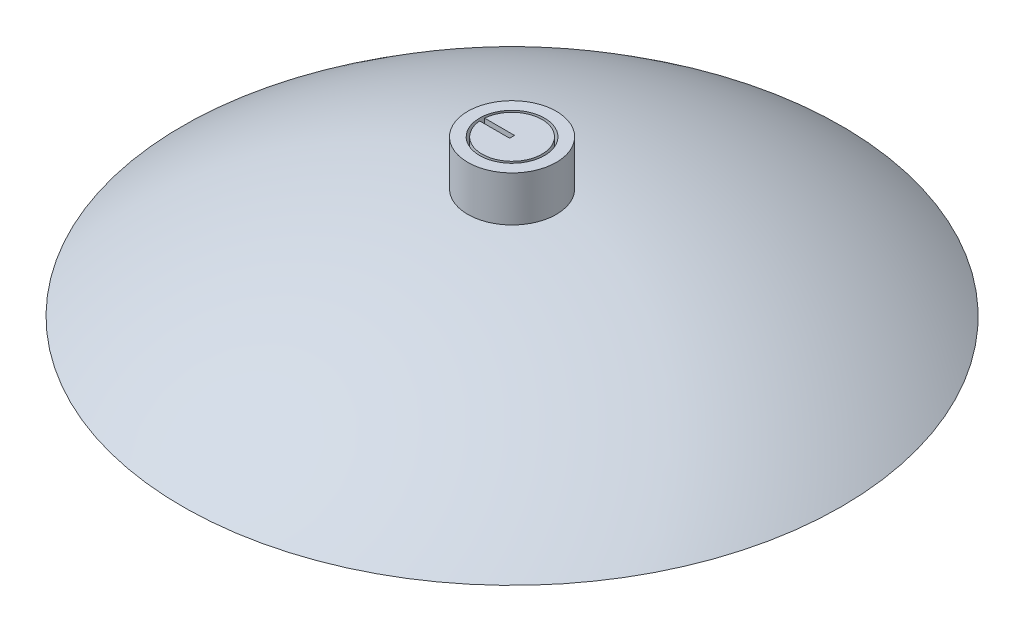
from build123d import *

# Parameters (mm, degrees)
BOSS_EXTRUDE1_REACH      = 319.128
BOSS_EXTRUDE1_END_RADIUS = 348.751469298
SKETCH2_R                = 28.575
CUT_EXTRUDE1_REACH       = 319.128
CUT_EXTRUDE1_END_RADIUS  = 348.751469298
SKETCH3_R                = 20.955
SKETCH3_R_2              = 19.3675
CUT_EXTRUDE2_REACH       = 319.128
CUT_EXTRUDE2_END_RADIUS  = 348.751469298
SKETCH6_R                = 6.985
BOSS_EXTRUDE4_DEPTH      = 19.05
SKETCH7_R                = 5.715
CUT_EXTRUDE3_DEPTH       = 16.51


with BuildPart() as part:
    # Sketch1 → Revolve1 (revolve)
    with BuildSketch(Plane.XY):
        with BuildLine():
            Line((212.725, 0), (191.135, 0))
            ThreePointArc((191.135, 0), (99.243909749, 39.232491681), (0, 50.8))
            Line((0, 50.8), (0, 72.39))
            ThreePointArc((0, 72.39), (112.352389522, 53.796868331), (212.725, 0))
        make_face()
    revolve(axis=Axis((0, 0, 0), (0, -1, 0)))

    # Boss-Extrude1: up to this sphere (the profile starts outside it)
    boss_extrude1_end = Location((0, -276.361469298, 0)) * Sphere(BOSS_EXTRUDE1_END_RADIUS, mode=Mode.PRIVATE)
    # Sketch2 → Boss-Extrude1 (add, up to the surface)
    with BuildSketch(Plane(origin=(0, 100.33, 0), x_dir=(1, 0, 0), z_dir=(0, 1, 0)), mode=Mode.PRIVATE) as boss_extrude1_sk1:
        with Locations(Location((0, 0, 0), (0, 0, 270))):
            Circle(SKETCH2_R)
    boss_extrude1_tool1 = extrude(boss_extrude1_sk1.sketch, amount=-BOSS_EXTRUDE1_REACH, mode=Mode.PRIVATE) - boss_extrude1_end
    add(boss_extrude1_tool1.solids().sort_by_distance((0, 100.33, 0))[0])

    # Cut-Extrude1: up to this sphere (the profile starts outside it)
    cut_extrude1_end = Location((0, -276.361469298, 0)) * Sphere(CUT_EXTRUDE1_END_RADIUS, mode=Mode.PRIVATE)
    # Sketch3 → Cut-Extrude1 (cut, up to the surface)
    with BuildSketch(Plane(origin=(0, 100.33, 0), x_dir=(1, 0, 0), z_dir=(0, 1, 0)), mode=Mode.PRIVATE) as cut_extrude1_sk1:
        with Locations(Location((0, 0, 0), (0, 0, 270))):
            Circle(SKETCH3_R)
        with Locations(Location((0, 0, 0), (0, 0, 270))):
            Circle(SKETCH3_R_2, mode=Mode.SUBTRACT)
    cut_extrude1_tool1 = extrude(cut_extrude1_sk1.sketch, amount=-CUT_EXTRUDE1_REACH, mode=Mode.PRIVATE) - cut_extrude1_end
    add(cut_extrude1_tool1.solids().sort_by_distance((0, 100.33, -20.362303))[0], mode=Mode.SUBTRACT)

    # Cut-Extrude2: up to this sphere (the profile starts outside it)
    cut_extrude2_end = Location((0, -276.361469298, 0)) * Sphere(CUT_EXTRUDE2_END_RADIUS, mode=Mode.PRIVATE)
    # Sketch4 → Cut-Extrude2 (cut, up to the surface)
    with BuildSketch(Plane(origin=(0, 100.33, 0), x_dir=(1, 0, 0), z_dir=(0, 1, 0)), mode=Mode.PRIVATE) as cut_extrude2_sk1:
        with BuildLine():
            Line((-19.302328875, 1.5875), (0, 1.5875))
            Line((0, 1.5875), (0, -1.5875))
            Line((0, -1.5875), (-19.302328875, -1.5875))
            ThreePointArc((-19.302328875, -1.5875), (-19.959892905, 0), (-19.302328875, 1.5875))
        make_face()
    cut_extrude2_tool1 = extrude(cut_extrude2_sk1.sketch, amount=-CUT_EXTRUDE2_REACH, mode=Mode.PRIVATE) - cut_extrude2_end
    add(cut_extrude2_tool1.solids().sort_by_distance((-9.878619, 100.33, 0))[0], mode=Mode.SUBTRACT)

    # Sketch6 → Boss-Extrude4 (add)
    with BuildSketch(Plane(origin=(0, 51.308, 0), x_dir=(1, 0, 0), z_dir=(0, 1, 0))):
        with Locations(Location((0, 0, 0), (0, 0, 270))):
            Circle(SKETCH6_R)
    extrude(amount=-BOSS_EXTRUDE4_DEPTH)

    # Sketch7 → Cut-Extrude3 (cut)
    with BuildSketch(Plane.XZ.offset(-32.258)):
        with Locations(Location((0, 0, 0), (0, 0, 270))):
            Circle(SKETCH7_R)
    extrude(amount=-CUT_EXTRUDE3_DEPTH, mode=Mode.SUBTRACT)


solid = part.part
